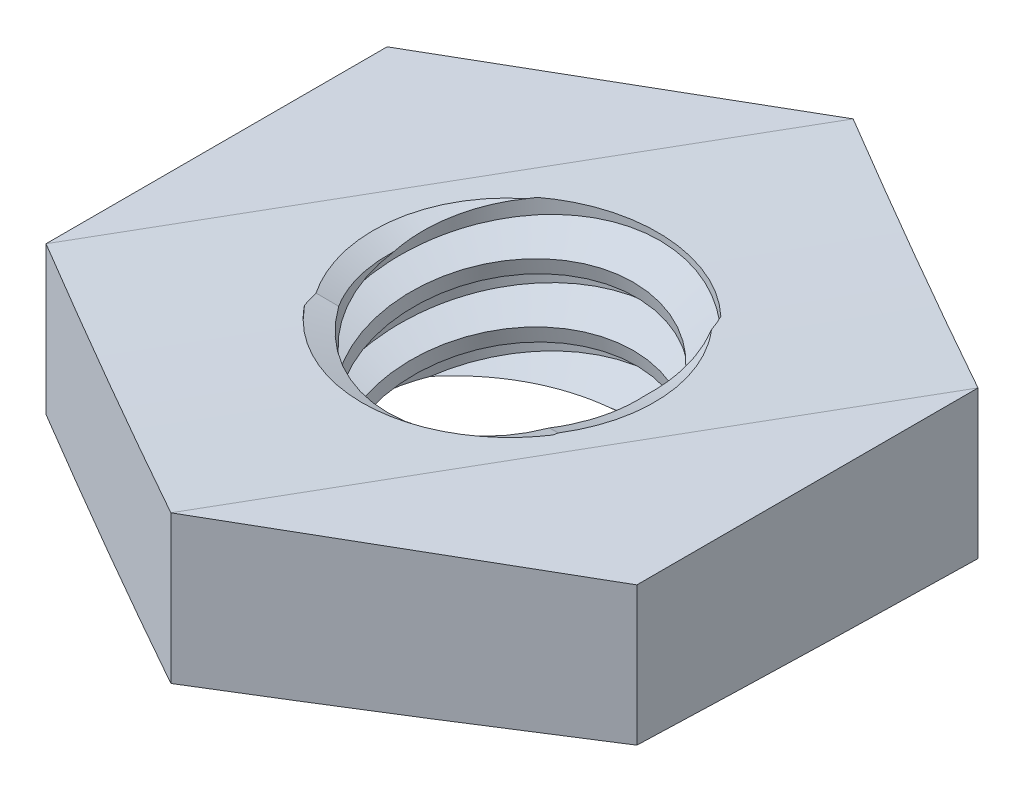
from build123d import *

# Parameters (mm, degrees)
EXTRUDE1_DEPTH      = 0.8
SKETCH2_W           = 1
SKETCH2_H           = 1.6
LPATTERN1_COUNT     = 4
LPATTERN1_PITCH     = 0.4
LPATTERN1_COL_COUNT = 2
LPATTERN1_COL_PITCH = 0.4
CUT_EXTRUDE1_DEPTH  = 10


with BuildPart() as part:
    # Sketch1 → Extrude1 (new, symmetric)
    with BuildSketch(Plane(origin=(0, 0, 0), x_dir=(1, 0, 0), z_dir=(0, 1, 0))):
        Polygon((0, 2.309401077), (-2, 1.154700538), (-2, -1.154700538), (0, -2.309401077), (2, -1.154700538), (2, 1.154700538), align=None)
    extrude(amount=EXTRUDE1_DEPTH, both=True)

    # Sketch4 → Cut-Revolve2 (revolve, cut)
    with BuildSketch(Plane(origin=(0, 0, 0), x_dir=(0, 0, -1), z_dir=(1, 0, 0))):
        Polygon((0, 0.8), (1, 0.8), (0.82201838, 0.717005807), (0.82201838, -0.717005807), (1, -0.8), (0, -0.8), align=None)
    revolve(axis=Axis((0, 0.8, 0), (0, 1, 0)), mode=Mode.SUBTRACT)


with BuildPart() as body_2:
    # Sketch2 → Revolve1 (revolve)
    with BuildSketch(Plane(origin=(0, 0, 0), x_dir=(0, 0, -1), z_dir=(1, 0, 0))):
        with Locations((0.5, 0)):
            Rectangle(SKETCH2_W, SKETCH2_H)
    revolve(axis=Axis((0, -1.8, 0), (0, 1, 0)))

    # Sketch3 → Cut-Revolve1 (revolve, cut)
    with BuildSketch(Plane(origin=(0, 0, 0), x_dir=(0, 0, -1), z_dir=(1, 0, 0)), mode=Mode.PRIVATE) as cut_revolve1_sk:
        Polygon((1.009805807, 0.750970966), (1.078446454, 0.40776773), (0.841629993, 0.487879925), (0.82201838, 0.585937993), align=None)
    cut_revolve1 = revolve(cut_revolve1_sk.sketch.rotate(Axis((0, 0.8, 0.085891176), (0, -0.9805806756909201, -0.19611613513818416)), 180), axis=Axis((0, 0.8, 0.085891176), (0, -0.9805806756909201, -0.19611613513818416)), mode=Mode.SUBTRACT)

    # LPattern1: Cut-Revolve1 ×4
    with Locations(*[(0, -i * LPATTERN1_PITCH, 0) for i in range(1, LPATTERN1_COUNT)]):
        add(cut_revolve1, mode=Mode.SUBTRACT)

    # LPattern1 col: Cut-Revolve1 ×2
    with Locations(*[(0, i * LPATTERN1_COL_PITCH, 0) for i in range(1, LPATTERN1_COL_COUNT)]):
        add(cut_revolve1, mode=Mode.SUBTRACT)


with BuildPart() as part_1:
    add(part.part)

    # Combine1: cut body 2
    add(body_2.part, mode=Mode.SUBTRACT)

    # Sketch8 → Cut-Extrude1 (cut)
    with BuildSketch(Plane(origin=(1, 0, -1.732050808), x_dir=(-0.8660254037844387, 0, -0.49999999999999983), z_dir=(0.49999999999999983, 0, -0.8660254037844387))):
        with BuildLine():
            ThreePointArc((-9.370997107, 2.18202908), (0, 0.779159881), (9.370997107, 2.18202908))
            add(Edge.make_bspline(
                [(9.370997107, 2.18202908), (-0.379082197, 7.669320015), (-9.370997107, 2.18202908)],
                knots=[0, 0, 0, 1, 1, 1], degree=2))
        make_face()
        with BuildLine():
            ThreePointArc((-10.64516129, 1.54327441), (0, -0.220840119), (10.64516129, 1.54327441))
            add(Edge.make_bspline(
                [(10.64516129, 1.54327441), (-0.0817748, -7.501419358), (-10.64516129, 1.54327441)],
                knots=[0, 0, 0, 1, 1, 1], degree=2))
        make_face()
    extrude(amount=-CUT_EXTRUDE1_DEPTH, mode=Mode.SUBTRACT)


solid = part_1.part
